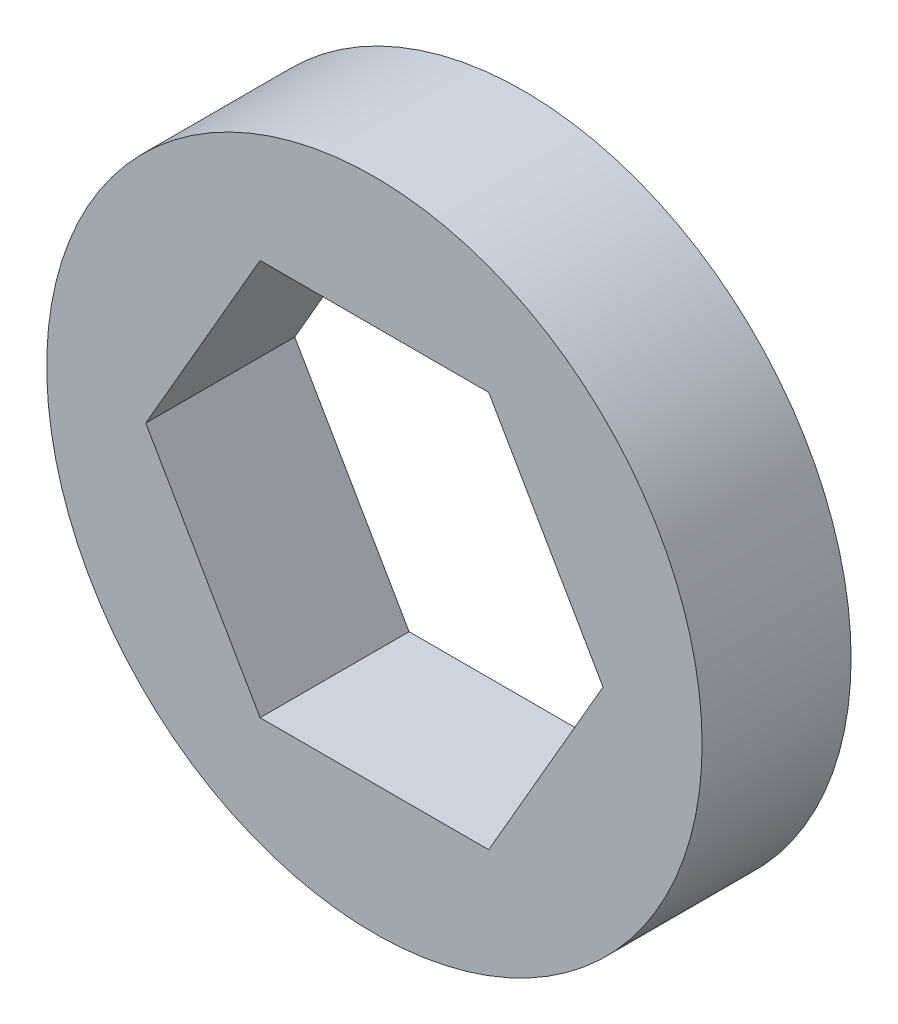
from build123d import *

# Parameters (mm, degrees)
SKETCH1_R           = 10.5029
BOSS_EXTRUDE1_DEPTH = 4.7752


with BuildPart() as part:
    # Sketch1 → Boss-Extrude1 (new body)
    with BuildSketch(Plane.XY):
        Circle(SKETCH1_R)
        Polygon((-7.3279, 0), (-3.66395, -6.346147556), (3.66395, -6.346147556), (7.3279, 0), (3.66395, 6.346147556), (-3.66395, 6.346147556), align=None, mode=Mode.SUBTRACT)
    extrude(amount=BOSS_EXTRUDE1_DEPTH)


solid = part.part
